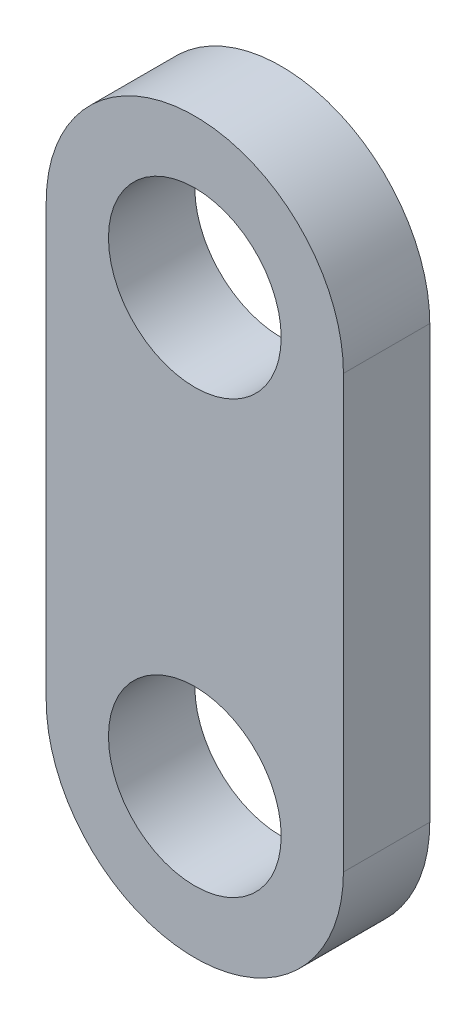
from build123d import *

# Parameters (mm, degrees)
CROQUIS1_R              = 4
SALIENTE_EXTRUIR1_DEPTH = 4


with BuildPart() as part:
    # Croquis1 → Saliente-Extruir1 (new body)
    with BuildSketch(Plane.XY):
        with BuildLine():
            Line((6.428571429, 6.266233766), (6.428571429, -13.733766234))
            ThreePointArc((6.428571429, -13.733766234), (-0.454545455, -20.616883117), (-7.337662338, -13.733766234))
            Line((-7.337662338, -13.733766234), (-7.337662338, 6.266233766))
            ThreePointArc((-7.337662338, 6.266233766), (-0.454545455, 13.149350649), (6.428571429, 6.266233766))
        make_face()
        with Locations((-0.454545455, 6.266233766)):
            Circle(CROQUIS1_R, mode=Mode.SUBTRACT)
        with Locations((-0.454545455, -13.733766234)):
            Circle(CROQUIS1_R, mode=Mode.SUBTRACT)
    extrude(amount=SALIENTE_EXTRUIR1_DEPTH)


solid = part.part
